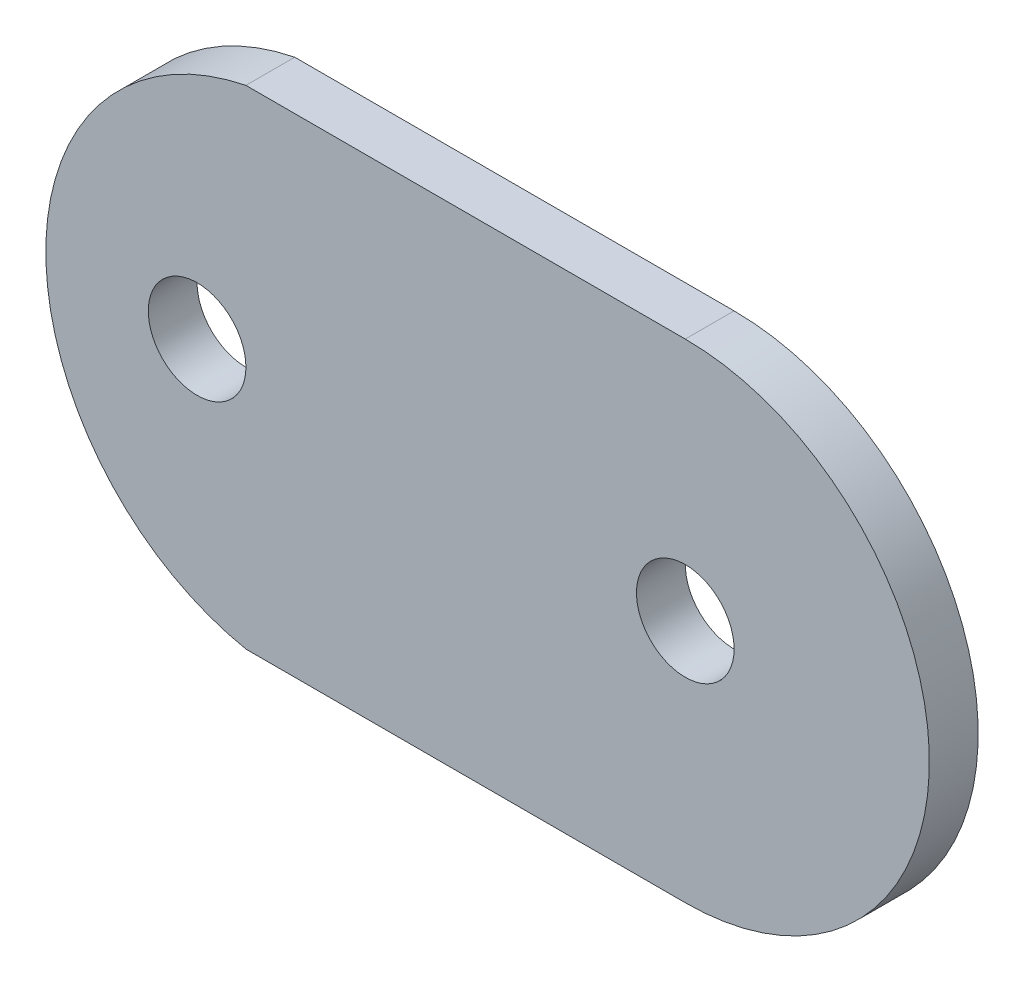
from build123d import *

# Parameters (mm, degrees)
SKETCH6_R           = 1
BOSS_EXTRUDE4_DEPTH = 1


with BuildPart() as part:
    # Sketch6 → Boss-Extrude4 (new body)
    with BuildSketch(Plane.XY):
        with BuildLine():
            Line((0, 10), (-3, 10))
            Line((-3, 10), (-4, 10))
            ThreePointArc((-4, 10), (-8.099019514, 5), (-4, 0))
            Line((-4, 0), (-3, 0))
            Line((-3, 0), (0, 0))
            Line((0, 0), (5, 0))
            ThreePointArc((5, 0), (10, 5), (5, 10))
            Line((5, 10), (0, 10))
        make_face()
        with Locations((5, 5)):
            Circle(SKETCH6_R, mode=Mode.SUBTRACT)
        with Locations((-5, 5)):
            Circle(SKETCH6_R, mode=Mode.SUBTRACT)
    extrude(amount=BOSS_EXTRUDE4_DEPTH)


solid = part.part
